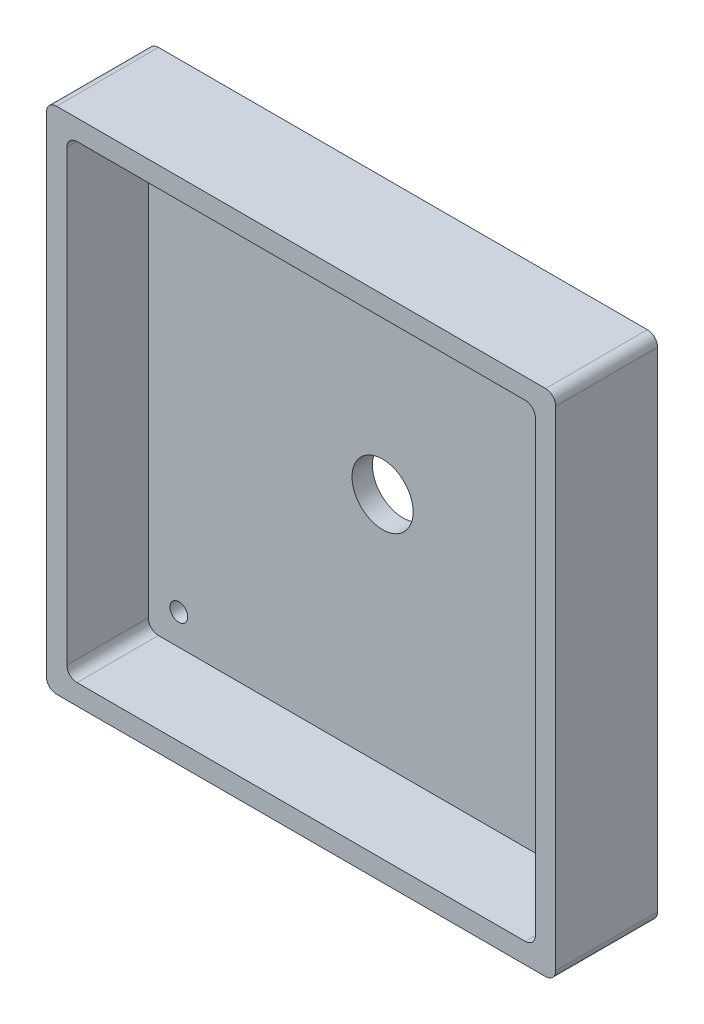
from build123d import *

# Parameters (mm, degrees)
SKETCH1_W           = 100
SKETCH1_H           = 100
BOSS_EXTRUDE1_DEPTH = 20
SKETCH2_W           = 92
SKETCH2_H           = 92
CUT_EXTRUDE1_DEPTH  = 16
FILLET1_R           = 2
SKETCH3_R           = 6
SKETCH3_R_2         = 1.75
CUT_EXTRUDE2_DEPTH  = 16


with BuildPart() as part:
    # Sketch1 → Boss-Extrude1 (new body)
    with BuildSketch(Plane.XY):
        Rectangle(SKETCH1_W, SKETCH1_H)
    extrude(amount=BOSS_EXTRUDE1_DEPTH)

    # Sketch2 → Cut-Extrude1 (cut)
    with BuildSketch(Plane.XY.offset(20)):
        Rectangle(SKETCH2_W, SKETCH2_H)
    extrude(amount=-CUT_EXTRUDE1_DEPTH, mode=Mode.SUBTRACT)

    # Fillet1
    fillet1_edges = [part.edges().sort_by_distance(p)[0] for p in [
        (-46, -46, 12),
        (-46, 46, 12),
        (46, 46, 12),
        (46, -46, 12),
        (-50, 50, 10),
        (50, 50, 10),
        (50, -50, 10),
        (-50, -50, 10),
    ]]
    fillet(fillet1_edges, radius=FILLET1_R)

    # Sketch3 → Cut-Extrude2 (cut)
    with BuildSketch(Plane.XY):
        Circle(SKETCH3_R)
        with Locations((-40, 40)):
            Circle(SKETCH3_R_2)
        with Locations((40, 40)):
            Circle(SKETCH3_R_2)
        with Locations((40, -40)):
            Circle(SKETCH3_R_2)
        with Locations((-40, -40)):
            Circle(SKETCH3_R_2)
    extrude(amount=CUT_EXTRUDE2_DEPTH, mode=Mode.SUBTRACT)


solid = part.part
